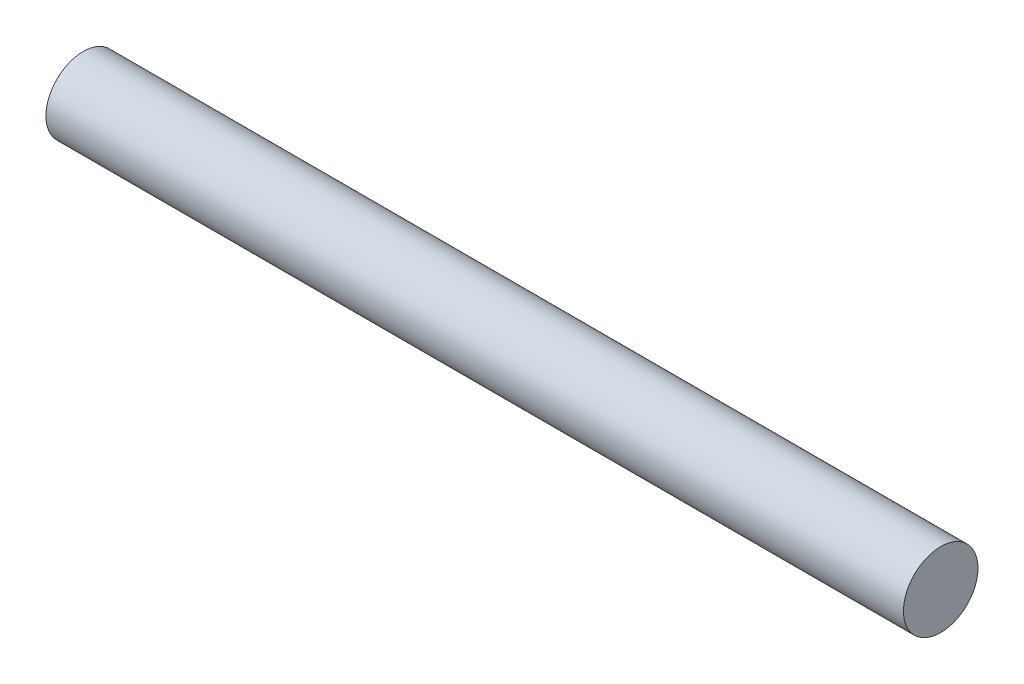
from build123d import *

# Parameters (mm, degrees)
SKETCH1_R           = 1
BOSS_EXTRUDE1_DEPTH = 23


with BuildPart() as part:
    # Sketch1 → Boss-Extrude1 (new body)
    with BuildSketch(Plane(origin=(0, 0, 0), x_dir=(0, 0, -1), z_dir=(1, 0, 0))):
        Circle(SKETCH1_R)
    extrude(amount=BOSS_EXTRUDE1_DEPTH)


solid = part.part
